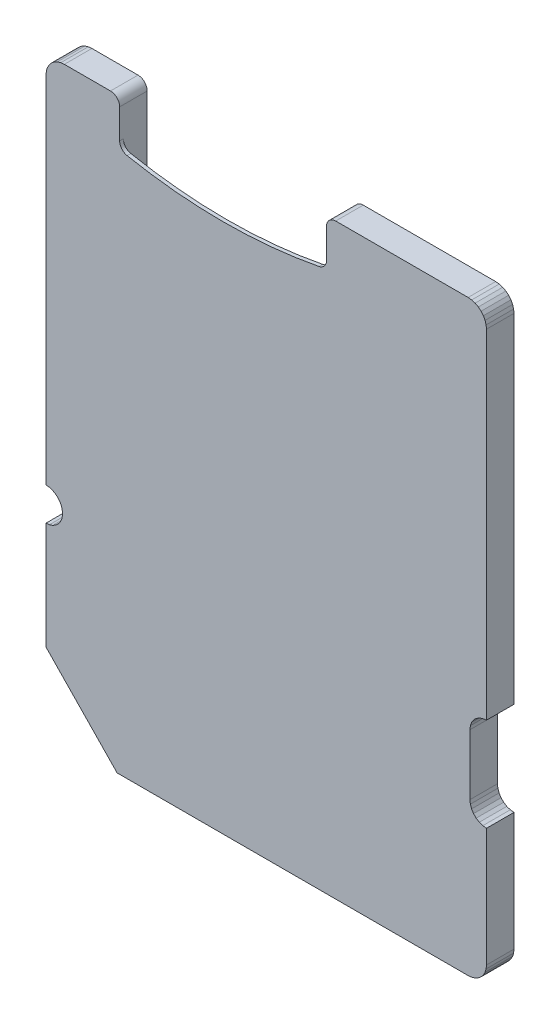
from build123d import *

# Parameters (mm, degrees)
AUFSATZ_LINEAR_START            = 0.1
AUFSATZ_LINEAR_AUSTRAGEN1_DEPTH = 1.5
SCHNITT_LINEAR_AUSTRAGEN1_DEPTH = 1.2
SKIZZE3_W                       = 13.0432381
SKIZZE3_H                       = 9.22364084
SCHNITT_LINEAR_AUSTRAGEN2_DEPTH = 1.4
SKIZZE4_W                       = 11.271857287
SKIZZE4_H                       = 8.011580578
SCHNITT_LINEAR_AUSTRAGEN3_DEPTH = 1.4
SCHNITT_LINEAR_AUSTRAGEN4_DEPTH = 152.434342208
VERRUNDUNG1_R                   = 0.5
VERRUNDUNG2_R                   = 0.5


with BuildPart() as part:
    # Skizze1 → Aufsatz-Linear austragen1 (new body)
    with BuildSketch(Plane.XY.offset(AUFSATZ_LINEAR_START)):
        Polygon((121.99509, -56.619215), (121.8, -56.6), (99.8, -56.6), (99.60491, -56.619215), (99.417317, -56.676121), (99.24443, -56.768531), (99.092894, -56.892894), (98.968531, -57.04443), (98.876121, -57.217317), (98.819215, -57.40491), (98.8, -57.6), (98.8, -76.95), (98.987121, -76.969667), (99.166063, -77.027809), (99.329007, -77.121885), (99.46883, -77.247782), (99.579423, -77.4), (99.655951, -77.571885), (99.69507, -77.755924), (99.69507, -77.944076), (99.655951, -78.128115), (99.579423, -78.3), (99.46883, -78.452218), (99.329007, -78.578115), (99.166063, -78.672191), (98.987121, -78.730333), (98.8, -78.75), (98.8, -84.6), (102.675, -88.6), (121.8, -88.6), (121.99509, -88.580785), (122.182683, -88.52388), (122.35557, -88.43147), (122.507107, -88.307107), (122.63147, -88.15557), (122.72388, -87.982683), (122.780785, -87.79509), (122.8, -87.6), (122.8, -81.15), (122.599731, -81.127435), (122.409505, -81.060872), (122.238859, -80.953648), (122.096352, -80.811141), (121.989128, -80.640495), (121.922565, -80.450269), (121.9, -80.25), (121.9, -76.95), (121.922565, -76.749731), (121.989128, -76.559505), (122.096352, -76.388859), (122.238859, -76.246352), (122.409505, -76.139128), (122.599731, -76.072565), (122.8, -76.05), (122.8, -57.6), (122.780785, -57.40491), (122.72388, -57.217317), (122.63147, -57.04443), (122.507107, -56.892893), (122.35557, -56.76853), (122.182683, -56.67612), align=None)
    extrude(amount=AUFSATZ_LINEAR_AUSTRAGEN1_DEPTH)

    # Skizze2 → Schnitt-Linear austragen1 (cut)
    with BuildSketch(Plane.XY):
        Polygon((102.017864846, -63.099173962), (102.017864846, -78.324168195), (105.146811161, -78.324168195), (105.146811161, -83.287975006), (120.056496088, -83.287975006), (120.056496088, -78.427117377), (120.827696552, -78.427117377), (120.827696552, -75.425497639), (116.267566255, -75.425497639), (116.267566255, -74.231533011), (118.554332467, -74.231533011), (118.554332467, -72.276257259), (120.6715821, -72.276257259), (120.6715821, -62.401228596), (118.309565205, -62.401228596), (118.309565205, -60.50461088), (115.061102946, -60.50461088), (115.061102946, -63.099173962), align=None)
    extrude(amount=SCHNITT_LINEAR_AUSTRAGEN1_DEPTH, mode=Mode.SUBTRACT)

    # Skizze3 → Schnitt-Linear austragen2 (cut)
    with BuildSketch(Plane.XY):
        with Locations((108.539483896, -67.710994382)):
            Rectangle(SKIZZE3_W, SKIZZE3_H)
    extrude(amount=SCHNITT_LINEAR_AUSTRAGEN2_DEPTH, mode=Mode.SUBTRACT)

    # Skizze4 → Schnitt-Linear austragen3 (cut)
    with BuildSketch(Plane.XY):
        with Locations((108.449834452, -59.786485977)):
            Rectangle(SKIZZE4_W, SKIZZE4_H)
    extrude(amount=SCHNITT_LINEAR_AUSTRAGEN3_DEPTH, mode=Mode.SUBTRACT)

    # Skizze5 → Schnitt-Linear austragen4 (cut, through all)
    with BuildSketch(Plane.XY):
        with BuildLine():
            Line((114.085763095, -56.6), (114.085763095, -59.115588122))
            ThreePointArc((114.085763095, -59.115588122), (108.449834452, -59.703189112), (102.813905808, -59.115588122))
            Line((102.813905808, -59.115588122), (102.813905808, -56.6))
            Line((102.813905808, -56.6), (114.085763095, -56.6))
        make_face()
    extrude(amount=SCHNITT_LINEAR_AUSTRAGEN4_DEPTH, mode=Mode.SUBTRACT)

    # Verrundung1
    verrundung1_edges = [part.edges().sort_by_distance(p)[0] for p in [
        (102.813905808, -56.6, 0.85),
        (114.085763095, -56.6, 0.85),
    ]]
    fillet(verrundung1_edges, radius=VERRUNDUNG1_R)

    # Verrundung2
    verrundung2_edges = [part.edges().sort_by_distance(p)[0] for p in [
        (114.085763095, -59.115588122, 1.5),
        (102.813905808, -59.115588122, 1.5),
    ]]
    fillet(verrundung2_edges, radius=VERRUNDUNG2_R)


solid = part.part
